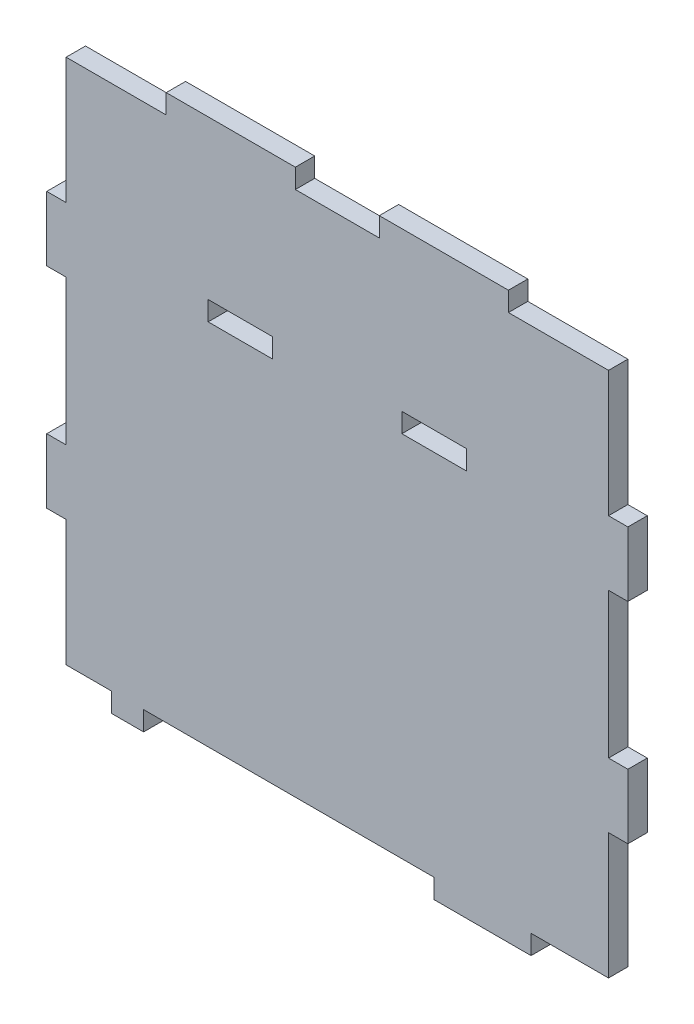
from build123d import *

# Parameters (mm, degrees)
ESQUISSE1_W                   = 180
ESQUISSE1_H                   = 175
BOSS_EXTRU_1_DEPTH            = 6
ESQUISSE2_W                   = 6
ESQUISSE2_H                   = 45
ESQUISSE2_W_2                 = 90
ESQUISSE2_H_2                 = 6
ESQUISSE2_W_3                 = 26
ENL_V_MAT_ENCOCHE_DEPTH       = 252.119493469
ESQUISSE3_W                   = 20
ESQUISSE3_H                   = 6
ENL_V_MAT_ENCOCHE_ETAGE_DEPTH = 252.119493469


with BuildPart() as part:
    # Esquisse1 → Boss.-Extru.1 (new body)
    with BuildSketch(Plane.XY):
        with Locations((-90, 87.5)):
            Rectangle(ESQUISSE1_W, ESQUISSE1_H)
    extrude(amount=BOSS_EXTRU_1_DEPTH)

    # Esquisse2 → Enlèv. mat encoche (cut, through all)
    with BuildSketch(Plane.XY.offset(6)):
        Polygon((-180, 0), (-174, 0), (-160, 0), (-160, 6), (-174, 6), (-174, 45), (-180, 45), align=None)
        with Locations((-177, 87.5)):
            Rectangle(ESQUISSE2_W, ESQUISSE2_H)
        Polygon((-180, 175), (-180, 130), (-174, 130), (-174, 169), (-143, 169), (-143, 175), align=None)
        with Locations((-105, 3)):
            Rectangle(ESQUISSE2_W_2, ESQUISSE2_H_2)
        Polygon((0, 0), (-6, 0), (-30, 0), (-30, 6), (-6, 6), (-6, 45), (0, 45), align=None)
        with Locations((-3, 87.5)):
            Rectangle(ESQUISSE2_W, ESQUISSE2_H)
        Polygon((0, 175), (0, 130), (-6, 130), (-6, 169), (-37, 169), (-37, 175), align=None)
        with Locations((-90, 172)):
            Rectangle(ESQUISSE2_W_3, ESQUISSE2_H_2)
    extrude(amount=-ENL_V_MAT_ENCOCHE_DEPTH, mode=Mode.SUBTRACT)

    # Esquisse3 → Enlèv. mat encoche etage (cut, through all)
    with BuildSketch(Plane.XY.offset(6)):
        with Locations((-120, 123)):
            Rectangle(ESQUISSE3_W, ESQUISSE3_H)
        with Locations((-60, 123)):
            Rectangle(ESQUISSE3_W, ESQUISSE3_H)
    extrude(amount=-ENL_V_MAT_ENCOCHE_ETAGE_DEPTH, mode=Mode.SUBTRACT)


solid = part.part
